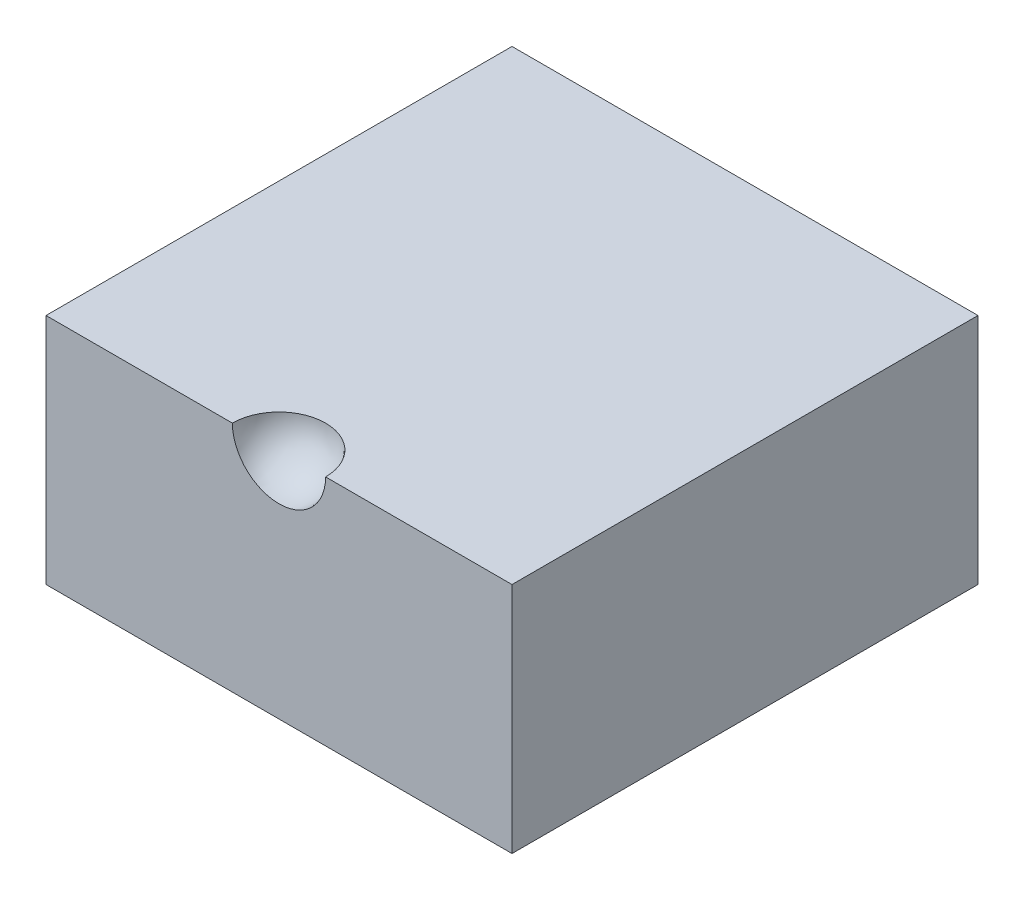
from build123d import *

# Parameters (mm, degrees)
SKETCH2_W           = 50
SKETCH2_H           = 50
BOSS_EXTRUDE1_DEPTH = 25


with BuildPart() as part:
    # Sketch2 → Boss-Extrude1 (new body)
    with BuildSketch(Plane(origin=(0, 0, 0), x_dir=(1, 0, 0), z_dir=(0, 1, 0))):
        Rectangle(SKETCH2_W, SKETCH2_H)
    extrude(amount=-BOSS_EXTRUDE1_DEPTH)

    # Sketch3 → Cut-Revolve1 (revolve, cut)
    with BuildSketch(Plane(origin=(0, 0, 0), x_dir=(1, 0, 0), z_dir=(0, 1, 0))):
        with BuildLine():
            Line((-5, -25), (5, -25))
            ThreePointArc((5, -25), (0, -20), (-5, -25))
        make_face()
    revolve(axis=Axis((-5, 0, 25), (1, 0, 0)), mode=Mode.SUBTRACT)


solid = part.part
